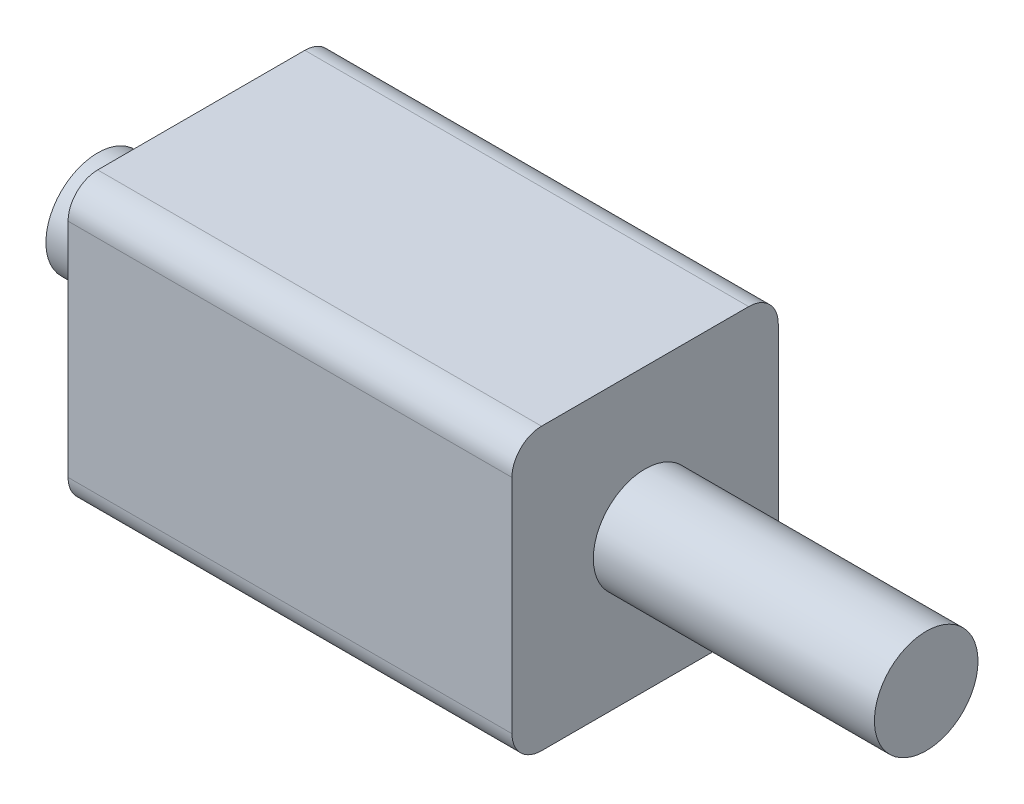
from build123d import *

# Parameters (mm, degrees)
SKETCH1_W                = 30
SKETCH1_H                = 18
BOSS_EXTRUDE1_DEPTH      = 19
BOSS_EXTRUDE2_DEPTH      = 19
BOSS_EXTRUDE2_DEPTH_BACK = 37
SKETCH2_R                = 3.5
FILLET1_R                = 2


with BuildPart() as part:
    # Sketch1 → Boss-Extrude1 (new body)
    with BuildSketch(Plane(origin=(0, 0, 0), x_dir=(1, 0, 0), z_dir=(0, 1, 0))):
        Rectangle(SKETCH1_W, SKETCH1_H)
    extrude(amount=BOSS_EXTRUDE1_DEPTH)

    # Sketch2 → Boss-Extrude2 (add, two sides: drawn at the far end of the back side and taken through both)
    with BuildSketch(Plane(origin=(15, 0, 0), x_dir=(0, 0, -1), z_dir=(1, 0, 0)).offset(-BOSS_EXTRUDE2_DEPTH_BACK)):
        with Locations((0, 9.5)):
            Circle(SKETCH2_R)
    extrude(amount=BOSS_EXTRUDE2_DEPTH + BOSS_EXTRUDE2_DEPTH_BACK)

    # Fillet1
    fillet1_edges = [part.edges().sort_by_distance(p)[0] for p in [
        (0, 19, 9),
        (0, 0, 9),
        (0, 0, -9),
        (0, 19, -9),
    ]]
    fillet(fillet1_edges, radius=FILLET1_R)


solid = part.part
